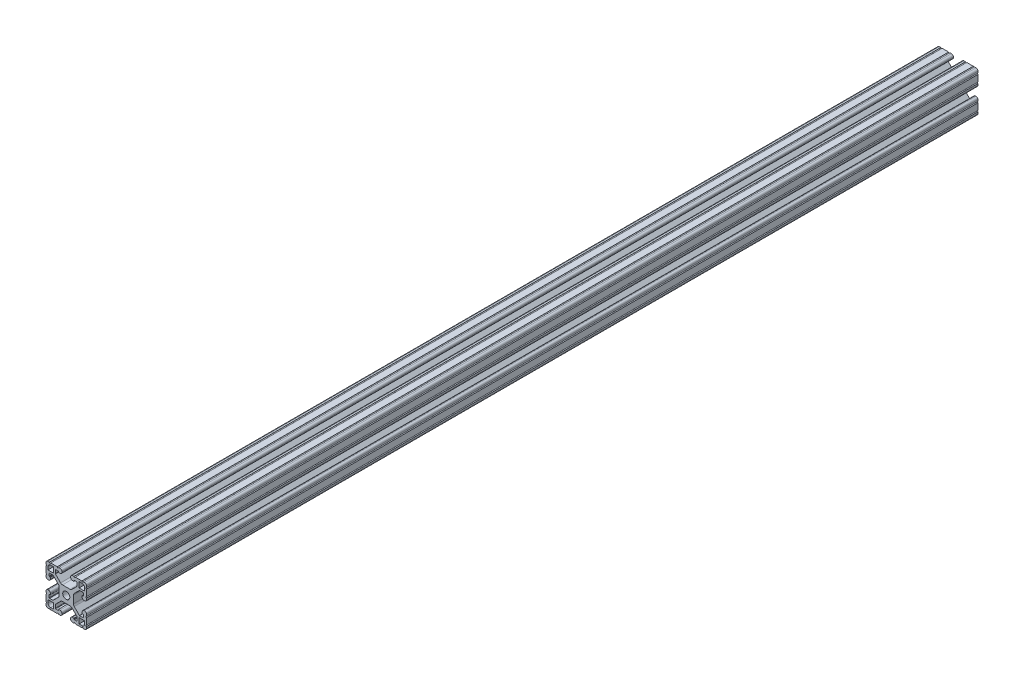
from build123d import *

# Parameters (mm, degrees)
BOSS_EXTRUDE1_DEPTH      = 431.8
BOSS_EXTRUDE1_DEPTH_BACK = 406.4
SKETCH3_W                = 38.1
SKETCH3_H                = 38.1
SKETCH4_W                = 5.207
SKETCH4_H                = 5.207
SKETCH4_R                = 3.3274
CUT_EXTRUDE1_DEPTH       = 839.632842786
CUT_EXTRUDE2_DEPTH       = 839.632842786
FILLET1_R                = 2.54
FILLET2_R                = 1.778
FILLET3_R                = 0.396875


with BuildPart() as part:
    # Sketch3 → Boss-Extrude1 (new, two sides: drawn at the far end of the back side and taken through both)
    with BuildSketch(Plane.XY.offset(-BOSS_EXTRUDE1_DEPTH_BACK)):
        Rectangle(SKETCH3_W, SKETCH3_H)
    extrude(amount=BOSS_EXTRUDE1_DEPTH + BOSS_EXTRUDE1_DEPTH_BACK)

    # Sketch4 → Cut-Extrude1 (cut, through all)
    with BuildSketch(Plane.XY.offset(431.8)):
        Polygon((7.239, 14.986), (4.064, 14.986), (4.064, 19.05), (-4.064, 19.05), (-4.064, 14.986), (-7.239, 14.986), (-7.239, 16.002), (-10.287, 16.002), (-10.287, 12.442261469), (-4.601138531, 6.7564), (4.601138531, 6.7564), (10.287, 12.442261469), (10.287, 16.002), (7.239, 16.002), align=None)
        Polygon((10.287, -12.442261469), (4.601138531, -6.7564), (-4.601138531, -6.7564), (-10.287, -12.442261469), (-10.287, -16.002), (-7.239, -16.002), (-7.239, -14.986), (-4.064, -14.986), (-4.064, -19.05), (4.064, -19.05), (4.064, -14.986), (7.239, -14.986), (7.239, -16.002), (10.287, -16.002), align=None)
        Polygon((-12.442261469, -10.287), (-6.7564, -4.601138531), (-6.7564, 4.601138531), (-12.442261469, 10.287), (-16.002, 10.287), (-16.002, 7.239), (-14.986, 7.239), (-14.986, 4.064), (-19.05, 4.064), (-19.05, -4.064), (-14.986, -4.064), (-14.986, -7.239), (-16.002, -7.239), (-16.002, -10.287), align=None)
        Polygon((14.986, -7.239), (14.986, -4.064), (19.05, -4.064), (19.05, 4.064), (14.986, 4.064), (14.986, 7.239), (16.002, 7.239), (16.002, 10.287), (12.442261469, 10.287), (6.7564, 4.601138531), (6.7564, -4.601138531), (12.442261469, -10.287), (16.002, -10.287), (16.002, -7.239), align=None)
        with Locations((14.6685, 14.6685)):
            Rectangle(SKETCH4_W, SKETCH4_H)
        with Locations((14.6685, -14.6685)):
            Rectangle(SKETCH4_W, SKETCH4_H)
        with Locations((-14.6685, 14.6685)):
            Rectangle(SKETCH4_W, SKETCH4_H)
        with Locations((-14.6685, -14.6685)):
            Rectangle(SKETCH4_W, SKETCH4_H)
        Circle(SKETCH4_R)
    extrude(amount=-CUT_EXTRUDE1_DEPTH, mode=Mode.SUBTRACT)

    # Sketch5 → Cut-Extrude2 (cut, through all)
    with BuildSketch(Plane.XY.offset(431.8)):
        with BuildLine():
            Line((-14.605, 19.05), (-15.875, 19.05))
            ThreePointArc((-15.875, 19.05), (-15.24, 18.415), (-14.605, 19.05))
        make_face()
        with BuildLine():
            Line((-7.239, 19.05), (-8.509, 19.05))
            ThreePointArc((-8.509, 19.05), (-7.874, 18.415), (-7.239, 19.05))
        make_face()
        with BuildLine():
            ThreePointArc((-19.05, 14.605), (-18.415, 15.24), (-19.05, 15.875))
            Line((-19.05, 15.875), (-19.05, 14.605))
        make_face()
        with BuildLine():
            ThreePointArc((-19.05, 7.239), (-18.415, 7.874), (-19.05, 8.509))
            Line((-19.05, 8.509), (-19.05, 7.239))
        make_face()
        with BuildLine():
            ThreePointArc((7.239, 19.05), (7.874, 18.415), (8.509, 19.05))
            Line((8.509, 19.05), (7.239, 19.05))
        make_face()
        with BuildLine():
            ThreePointArc((14.605, 19.05), (15.24, 18.415), (15.875, 19.05))
            Line((15.875, 19.05), (14.605, 19.05))
        make_face()
        with BuildLine():
            Line((19.05, 14.605), (19.05, 15.875))
            ThreePointArc((19.05, 15.875), (18.415, 15.24), (19.05, 14.605))
        make_face()
        with BuildLine():
            Line((19.05, 7.239), (19.05, 8.509))
            ThreePointArc((19.05, 8.509), (18.415, 7.874), (19.05, 7.239))
        make_face()
        with BuildLine():
            ThreePointArc((19.05, -7.239), (18.415, -7.874), (19.05, -8.509))
            Line((19.05, -8.509), (19.05, -7.239))
        make_face()
        with BuildLine():
            ThreePointArc((19.05, -14.605), (18.415, -15.24), (19.05, -15.875))
            Line((19.05, -15.875), (19.05, -14.605))
        make_face()
        with BuildLine():
            Line((14.605, -19.05), (15.875, -19.05))
            ThreePointArc((15.875, -19.05), (15.24, -18.415), (14.605, -19.05))
        make_face()
        with BuildLine():
            Line((7.239, -19.05), (8.509, -19.05))
            ThreePointArc((8.509, -19.05), (7.874, -18.415), (7.239, -19.05))
        make_face()
        with BuildLine():
            ThreePointArc((-7.239, -19.05), (-7.874, -18.415), (-8.509, -19.05))
            Line((-8.509, -19.05), (-7.239, -19.05))
        make_face()
        with BuildLine():
            ThreePointArc((-14.605, -19.05), (-15.24, -18.415), (-15.875, -19.05))
            Line((-15.875, -19.05), (-14.605, -19.05))
        make_face()
        with BuildLine():
            Line((-19.05, -14.605), (-19.05, -15.875))
            ThreePointArc((-19.05, -15.875), (-18.415, -15.24), (-19.05, -14.605))
        make_face()
        with BuildLine():
            Line((-19.05, -7.239), (-19.05, -8.509))
            ThreePointArc((-19.05, -8.509), (-18.415, -7.874), (-19.05, -7.239))
        make_face()
    extrude(amount=-CUT_EXTRUDE2_DEPTH, mode=Mode.SUBTRACT)

    # Fillet1
    fillet1_edges = [part.edges().sort_by_distance(p)[0] for p in [
        (6.7564, -4.601138531, 12.7),
        (6.7564, 4.601138531, 12.7),
        (-17.272, 17.272, 12.7),
        (-17.272, -17.272, 12.7),
        (17.272, -17.272, 12.7),
        (17.272, 17.272, 12.7),
        (-4.601138531, -6.7564, 12.7),
        (4.601138531, -6.7564, 12.7),
        (-6.7564, 4.601138531, 12.7),
        (-6.7564, -4.601138531, 12.7),
        (4.601138531, 6.7564, 12.7),
        (-4.601138531, 6.7564, 12.7),
    ]]
    fillet(fillet1_edges, radius=FILLET1_R)

    # Fillet2
    fillet2_edges = [part.edges().sort_by_distance(p)[0] for p in [
        (14.986, 4.064, 12.7),
        (19.05, 4.064, 12.7),
        (19.05, -4.064, 12.7),
        (14.986, -4.064, 12.7),
        (4.064, -14.986, 12.7),
        (4.064, -19.05, 12.7),
        (-4.064, -19.05, 12.7),
        (-4.064, -14.986, 12.7),
        (-14.986, -4.064, 12.7),
        (-19.05, -4.064, 12.7),
        (-19.05, 4.064, 12.7),
        (-14.986, 4.064, 12.7),
        (-19.05, 19.05, 12.7),
        (19.05, 19.05, 12.7),
        (19.05, -19.05, 12.7),
        (-19.05, -19.05, 12.7),
        (-4.064, 14.986, 12.7),
        (-4.064, 19.05, 12.7),
        (4.064, 19.05, 12.7),
        (4.064, 14.986, 12.7),
    ]]
    fillet(fillet2_edges, radius=FILLET2_R)

    # Fillet3
    fillet3_edges = [part.edges().sort_by_distance(p)[0] for p in [
        (12.442261469, 10.287, 12.7),
        (16.002, 10.287, 12.7),
        (16.002, 7.239, 12.7),
        (16.002, -7.239, 12.7),
        (16.002, -10.287, 12.7),
        (12.442261469, -10.287, 12.7),
        (-7.239, -16.002, 12.7),
        (-10.287, -16.002, 12.7),
        (-10.287, -12.442261469, 12.7),
        (10.287, -12.442261469, 12.7),
        (10.287, -16.002, 12.7),
        (7.239, -16.002, 12.7),
        (-16.002, 7.239, 12.7),
        (-16.002, 10.287, 12.7),
        (-12.442261469, 10.287, 12.7),
        (-12.442261469, -10.287, 12.7),
        (-16.002, -10.287, 12.7),
        (-14.986, -7.239, 12.7),
        (-10.287, 12.442261469, 12.7),
        (-10.287, 16.002, 12.7),
        (-7.239, 16.002, 12.7),
        (7.239, 16.002, 12.7),
        (10.287, 16.002, 12.7),
        (10.287, 12.442261469, 12.7),
    ]]
    fillet(fillet3_edges, radius=FILLET3_R)


solid = part.part
